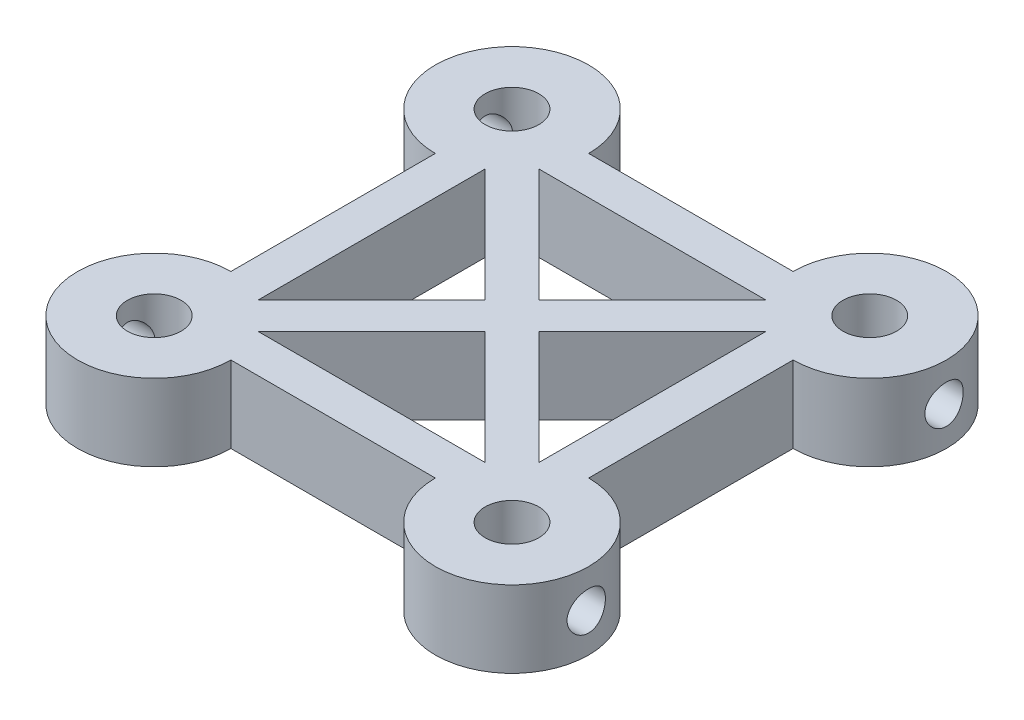
from build123d import *

# Parameters (mm, degrees)
SKETCH1_W           = 28
SKETCH1_H           = 28
BOSS_EXTRUDE1_DEPTH = 6
SKETCH2_R           = 6
BOSS_EXTRUDE2_DEPTH = 6
SKETCH3_R           = 2.1
CUT_EXTRUDE1_DEPTH  = 49.456165758
CUT_EXTRUDE2_DEPTH  = 10
SKETCH5_R           = 1.5
CUT_EXTRUDE3_DEPTH  = 10
CUT_EXTRUDE4_START  = 10
SKETCH6_R           = 1.5
CUT_EXTRUDE4_DEPTH  = 10


with BuildPart() as part:
    # Sketch1 → Boss-Extrude1 (new body)
    with BuildSketch(Plane(origin=(0, 0, 0), x_dir=(1, 0, 0), z_dir=(0, 1, 0))):
        with Locations((14, 14)):
            Rectangle(SKETCH1_W, SKETCH1_H)
    extrude(amount=BOSS_EXTRUDE1_DEPTH)

    # Sketch2 → Boss-Extrude2 (add)
    with BuildSketch(Plane(origin=(0, 6, 0), x_dir=(1, 0, 0), z_dir=(0, 1, 0))):
        with Locations((0, 28)):
            Circle(SKETCH2_R)
        with Locations((28, 28)):
            Circle(SKETCH2_R)
        with Locations((28, 0)):
            Circle(SKETCH2_R)
        Circle(SKETCH2_R)
    extrude(amount=-BOSS_EXTRUDE2_DEPTH)

    # Sketch3 → Cut-Extrude1 (cut, through all)
    with BuildSketch(Plane(origin=(0, 6, 0), x_dir=(1, 0, 0), z_dir=(0, 1, 0))):
        with Locations(Location((0, 28, 0), (0, 0, 270))):
            Circle(SKETCH3_R)
        with Locations(Location((28, 28, 0), (0, 0, 90))):
            Circle(SKETCH3_R)
        with Locations(Location((28, 0, 0), (0, 0, 270))):
            Circle(SKETCH3_R)
        with Locations(Location((0, 0, 0), (0, 0, 90))):
            Circle(SKETCH3_R)
    extrude(amount=-CUT_EXTRUDE1_DEPTH, mode=Mode.SUBTRACT)

    # Sketch4 → Cut-Extrude2 (cut)
    with BuildSketch(Plane(origin=(0, 6, 0), x_dir=(1, 0, 0), z_dir=(0, 1, 0))):
        Polygon((11.878679656, 14), (3, 22.878679656), (3, 5.121320344), align=None)
        Polygon((22.878679656, 25), (5.121320344, 25), (14, 16.121320344), align=None)
        Polygon((25, 5.121320344), (25, 22.878679656), (16.121320344, 14), align=None)
        Polygon((14, 11.878679656), (5.121320344, 3), (22.878679656, 3), align=None)
    extrude(amount=-CUT_EXTRUDE2_DEPTH, mode=Mode.SUBTRACT)

    # Sketch5 → Cut-Extrude3 (cut)
    with BuildSketch(Plane(origin=(28, 0, 0), x_dir=(0, 0, -1), z_dir=(1, 0, 0))):
        with Locations(Location((0, 3, 0), (0, 0, 180))):
            Circle(SKETCH5_R)
        with Locations(Location((28, 3, 0), (0, 0, 180))):
            Circle(SKETCH5_R)
    extrude(amount=CUT_EXTRUDE3_DEPTH, mode=Mode.SUBTRACT)

    # Sketch6 → Cut-Extrude4 (cut)
    with BuildSketch(Plane.ZY.offset(CUT_EXTRUDE4_START)):
        with Locations((-28, 3)):
            Circle(SKETCH6_R)
        with Locations((0, 3)):
            Circle(SKETCH6_R)
    extrude(amount=-CUT_EXTRUDE4_DEPTH, mode=Mode.SUBTRACT)


solid = part.part
